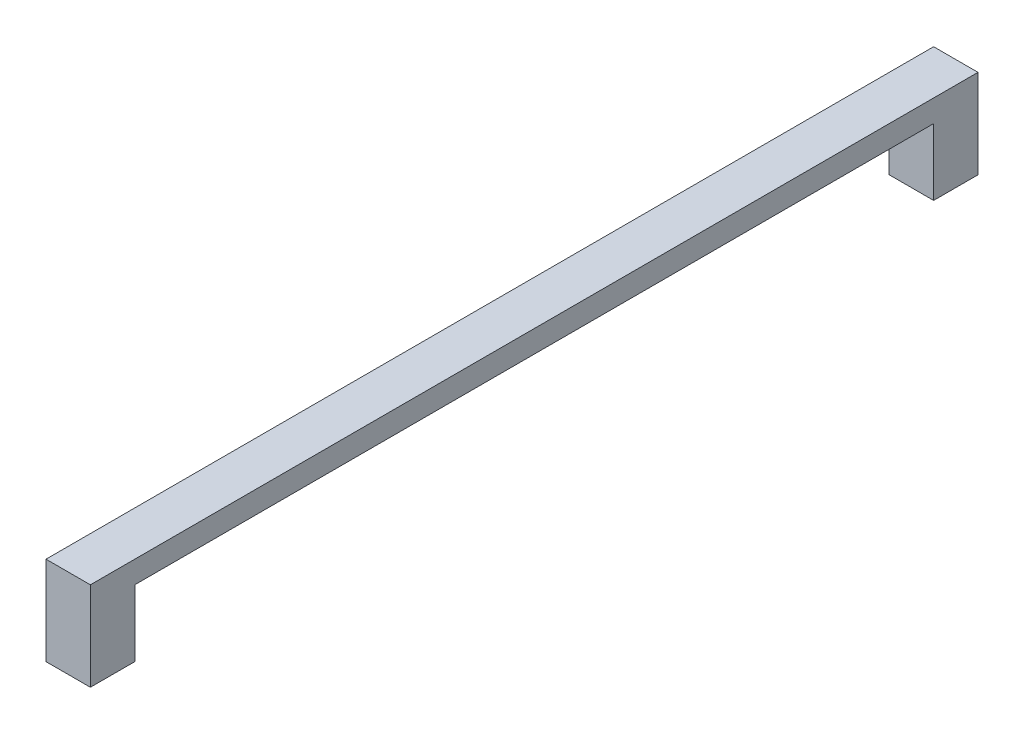
from build123d import *

# Parameters (mm, degrees)
BOSS_EXTRUDE1_DEPTH = 100


with BuildPart() as part:
    # Sketch2 → Boss-Extrude1 (new body)
    with BuildSketch(Plane(origin=(0, 0, 0), x_dir=(0, 0, -1), z_dir=(1, 0, 0))):
        Polygon((-43.462606731, 120.288465453), (1756.537393269, 120.288465453), (1756.537393269, -29.711534547), (1856.537393269, -29.711534547), (1856.537393269, 120.288465453), (1856.537393269, 170.288465453), (-143.462606731, 170.288465453), (-143.462606731, 120.288465453), (-143.462606731, -29.711534547), (-43.462606731, -29.711534547), align=None)
    extrude(amount=BOSS_EXTRUDE1_DEPTH)


solid = part.part
